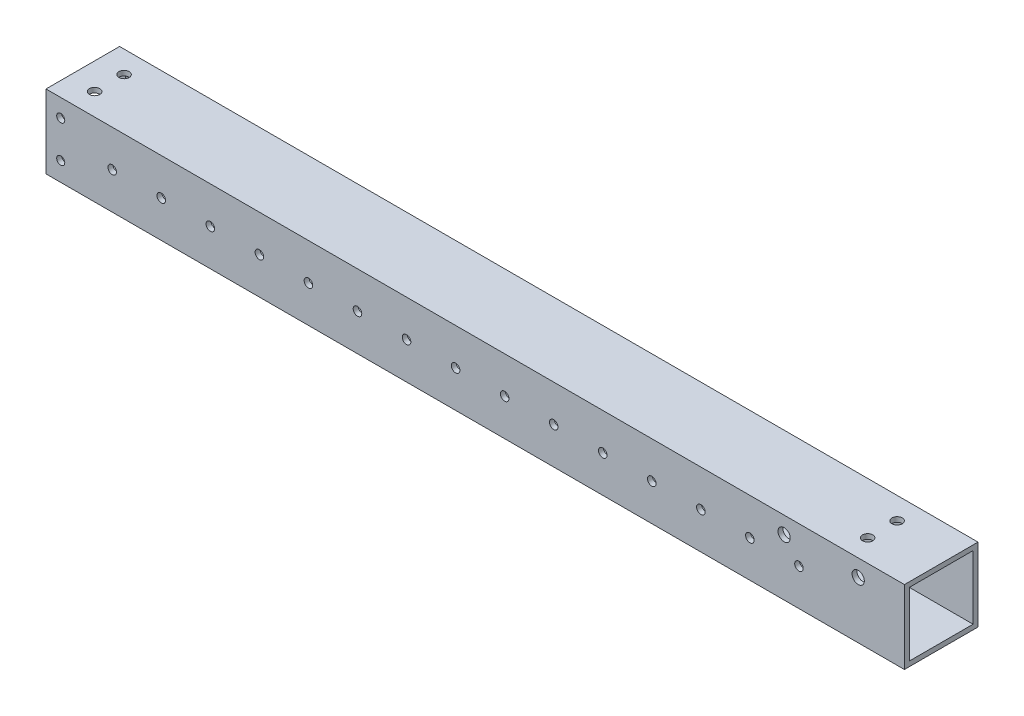
from build123d import *

# Parameters (mm, degrees)
SKETCH_1_W          = 30
SKETCH_1_H          = 30
SKETCH_1_W_2        = 26
SKETCH_1_H_2        = 26
EXTRUDE_1_DEPTH     = 350
SKETCH_2_R          = 1.75
CUT_EXTRUDE_1_DEPTH = 352.603469835
SKETCH_3_R          = 1.65
CUT_EXTRUDE_2_DEPTH = 352.603469835
SKETCH_4_R          = 2.1
CUT_EXTRUDE_3_DEPTH = 352.603469835
SKETCH_5_R          = 2.1
CUT_EXTRUDE_4_DEPTH = 352.603469835
SKETCH_6_R          = 2.5
CUT_EXTRUDE_5_DEPTH = 352.603469835


with BuildPart() as part:
    # 草图1 → 凸台-拉伸1 (new body)
    with BuildSketch(Plane(origin=(0, 0, 0), x_dir=(0, 0, -1), z_dir=(1, 0, 0))):
        Rectangle(SKETCH_1_W, SKETCH_1_H)
        Rectangle(SKETCH_1_W_2, SKETCH_1_H_2, mode=Mode.SUBTRACT)
    extrude(amount=EXTRUDE_1_DEPTH)

    # 草图2 → 切除-拉伸1 (cut, through all)
    with BuildSketch(Plane(origin=(0, 0, -15), x_dir=(-1, 0, 0), z_dir=(0, 0, -1))):
        with Locations((-307, 0)):
            Circle(SKETCH_2_R)
        with Locations((-287, 0)):
            Circle(SKETCH_2_R)
        with Locations((-267, 0)):
            Circle(SKETCH_2_R)
        with Locations((-247, 0)):
            Circle(SKETCH_2_R)
        with Locations((-227, 0)):
            Circle(SKETCH_2_R)
        with Locations((-207, 0)):
            Circle(SKETCH_2_R)
        with Locations((-187, 0)):
            Circle(SKETCH_2_R)
        with Locations((-167, 0)):
            Circle(SKETCH_2_R)
        with Locations((-147, 0)):
            Circle(SKETCH_2_R)
        with Locations((-127, 0)):
            Circle(SKETCH_2_R)
        with Locations((-107, 0)):
            Circle(SKETCH_2_R)
        with Locations((-87, 0)):
            Circle(SKETCH_2_R)
        with Locations((-67, 0)):
            Circle(SKETCH_2_R)
        with Locations((-47, 0)):
            Circle(SKETCH_2_R)
        with Locations((-27, 0)):
            Circle(SKETCH_2_R)
    extrude(amount=-CUT_EXTRUDE_1_DEPTH, mode=Mode.SUBTRACT)

    # 草图3 → 切除-拉伸2 (cut, through all)
    with BuildSketch(Plane.XY.offset(15)):
        with Locations((6, 7.724871585)):
            Circle(SKETCH_3_R)
        with Locations((6, -7.275128415)):
            Circle(SKETCH_3_R)
    extrude(amount=-CUT_EXTRUDE_2_DEPTH, mode=Mode.SUBTRACT)

    # 草图4 → 切除-拉伸3 (cut, through all)
    with BuildSketch(Plane(origin=(0, 15, 0), x_dir=(1, 0, 0), z_dir=(0, 1, 0))):
        with Locations(Location((326, 6, 0), (0, 0, 270))):
            Circle(SKETCH_4_R)
        with Locations(Location((326, -6, 0), (0, 0, 270))):
            Circle(SKETCH_4_R)
    extrude(amount=-CUT_EXTRUDE_3_DEPTH, mode=Mode.SUBTRACT)

    # 草图5 → 切除-拉伸4 (cut, through all)
    with BuildSketch(Plane.XZ.offset(15)):
        with Locations(Location((10.831487119, 6, 0), (0, 0, 270))):
            Circle(SKETCH_5_R)
        with Locations(Location((10.831487119, -6, 0), (0, 0, 270))):
            Circle(SKETCH_5_R)
    extrude(amount=-CUT_EXTRUDE_4_DEPTH, mode=Mode.SUBTRACT)

    # 草图6 → 切除-拉伸5 (cut, through all)
    with BuildSketch(Plane(origin=(0, 0, -15), x_dir=(-1, 0, 0), z_dir=(0, 0, -1))):
        with Locations((-331.15, 8.1)):
            Circle(SKETCH_6_R)
        with Locations((-300.95, 8.1)):
            Circle(SKETCH_6_R)
    extrude(amount=-CUT_EXTRUDE_5_DEPTH, mode=Mode.SUBTRACT)


solid = part.part
